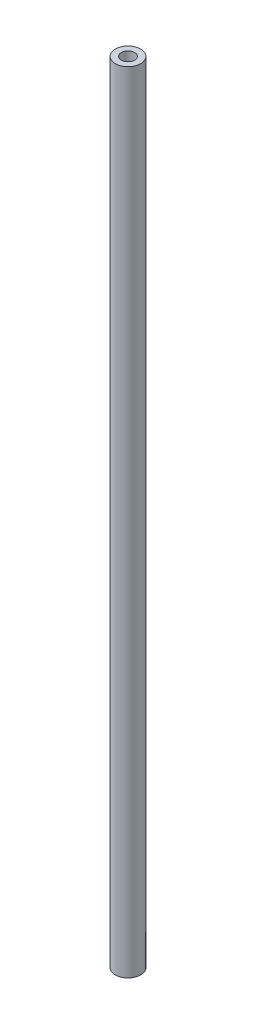
from build123d import *

# Parameters (mm, degrees)
SKETCH1_R           = 0.3207
SKETCH1_R_2         = 0.1685
BOSS_EXTRUDE1_DEPTH = 20


with BuildPart() as part:
    # Sketch1 → Boss-Extrude1 (new body)
    with BuildSketch(Plane(origin=(0, 0, 0), x_dir=(1, 0, 0), z_dir=(0, 1, 0))):
        with Locations(Location((0, 0, 0), (0, 0, 270))):
            Circle(SKETCH1_R)
        with Locations(Location((0, 0, 0), (0, 0, 270))):
            Circle(SKETCH1_R_2, mode=Mode.SUBTRACT)
    extrude(amount=BOSS_EXTRUDE1_DEPTH)


solid = part.part
